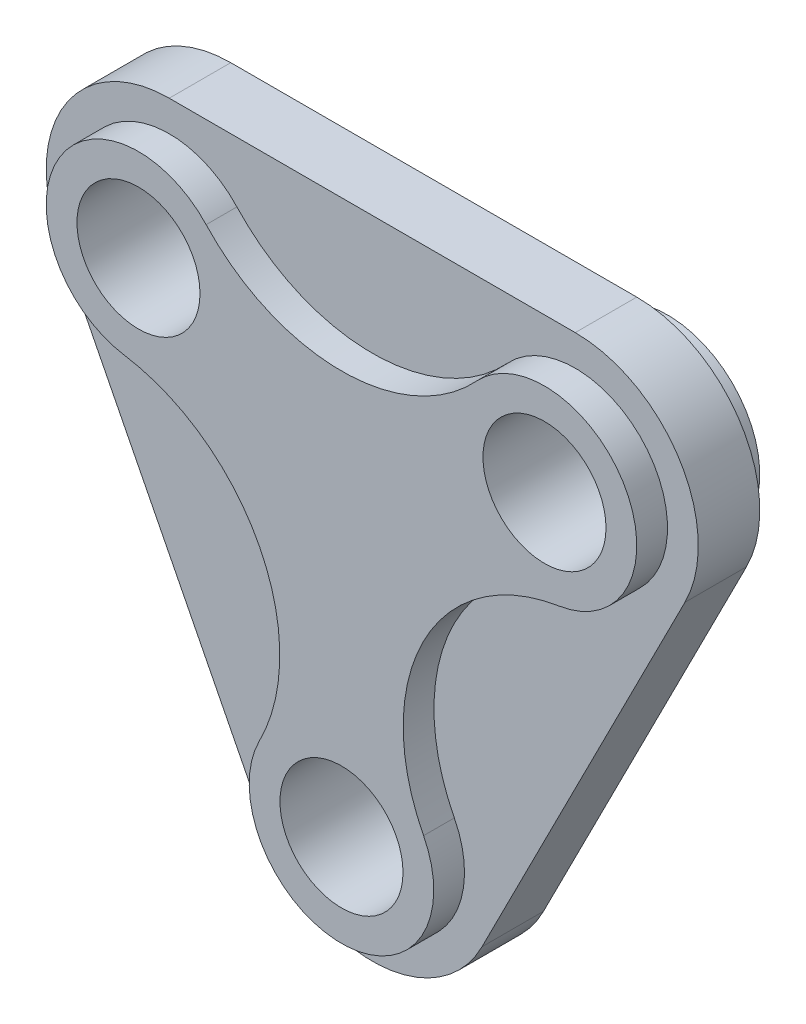
from build123d import *

# Parameters (mm, degrees)
SKETCH1_R           = 10
BOSS_EXTRUDE1_DEPTH = 10
BOSS_EXTRUDE2_DEPTH = 5


with BuildPart() as part:
    # Sketch1 → Boss-Extrude1 (new, symmetric)
    with BuildSketch(Plane.XY):
        with BuildLine():
            ThreePointArc((-35.344077706, 50.184288755), (-13.282230039, 34.133637057), (-13.344077706, 6.850955421))
            ThreePointArc((-13.344077706, 6.850955421), (0, -15), (13.344077706, 6.850955421))
            ThreePointArc((13.344077706, 6.850955421), (13.282230039, 34.133637057), (35.344077706, 50.184288755))
            ThreePointArc((35.344077706, 50.184288755), (46.234544698, 72.060228511), (22, 75.198039027))
            ThreePointArc((22, 75.198039027), (0, 65.594117082), (-22, 75.198039027))
            ThreePointArc((-22, 75.198039027), (-46.234544698, 72.060228511), (-35.344077706, 50.184288755))
        make_face()
        Circle(SKETCH1_R, mode=Mode.SUBTRACT)
        with Locations((-33, 65)):
            Circle(SKETCH1_R, mode=Mode.SUBTRACT)
        with Locations((33, 65)):
            Circle(SKETCH1_R, mode=Mode.SUBTRACT)
    extrude(amount=BOSS_EXTRUDE1_DEPTH, both=True)

    # Sketch1<3> → Boss-Extrude2 (add, symmetric)
    with BuildSketch(Plane.XY):
        with BuildLine():
            ThreePointArc((-33, 85), (-50.045189115, 75.462386346), (-50.833335385, 55.946152804))
            Line((-50.833335385, 55.946152804), (-17.833335385, -9.053847196))
            ThreePointArc((-17.833335385, -9.053847196), (0, -20), (17.833335385, -9.053847196))
            Line((17.833335385, -9.053847196), (50.833335385, 55.946152804))
            ThreePointArc((50.833335385, 55.946152804), (50.045189115, 75.462386346), (33, 85))
            Line((33, 85), (-33, 85))
        make_face()
        with BuildLine():
            ThreePointArc((13.344077706, 6.850955421), (0, -15), (-13.344077706, 6.850955421))
            ThreePointArc((-13.344077706, 6.850955421), (-13.282230039, 34.133637057), (-35.344077706, 50.184288755))
            ThreePointArc((-35.344077706, 50.184288755), (-46.234544698, 72.060228511), (-22, 75.198039027))
            ThreePointArc((-22, 75.198039027), (0, 65.594117082), (22, 75.198039027))
            ThreePointArc((22, 75.198039027), (46.234544698, 72.060228511), (35.344077706, 50.184288755))
            ThreePointArc((35.344077706, 50.184288755), (13.282230039, 34.133637057), (13.344077706, 6.850955421))
        make_face(mode=Mode.SUBTRACT)
    extrude(amount=BOSS_EXTRUDE2_DEPTH, both=True)


solid = part.part
